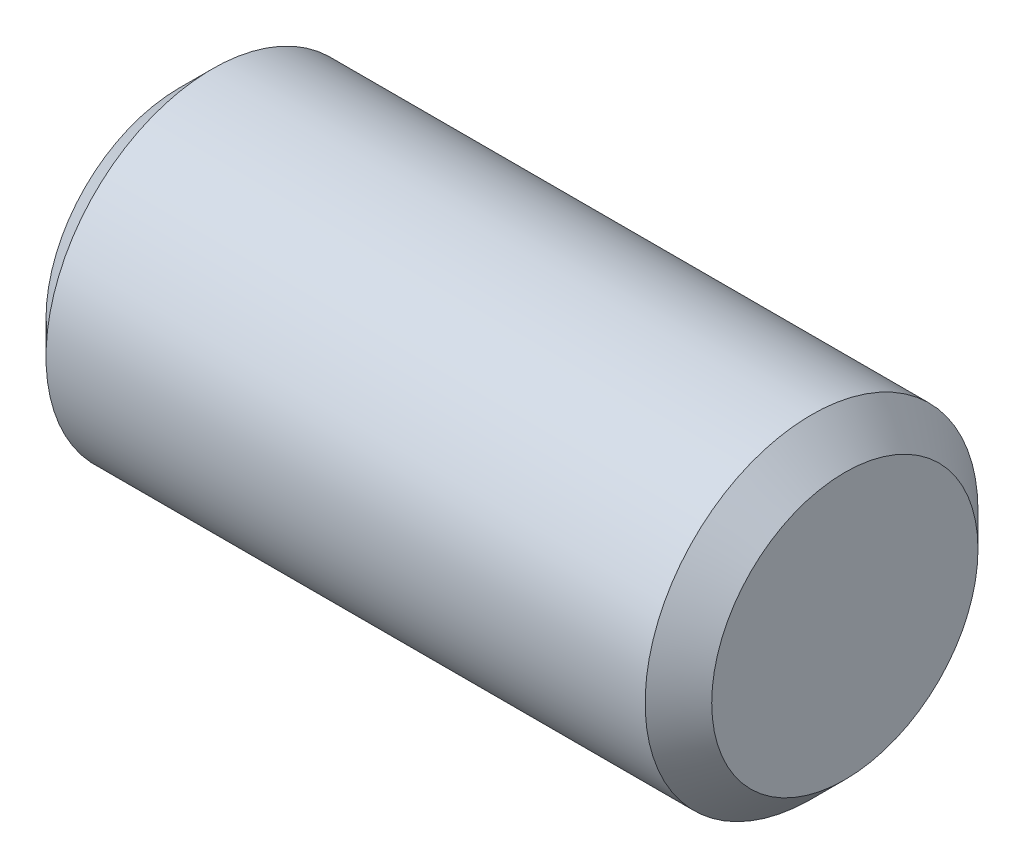
from build123d import *

# Parameters (mm, degrees)
EXTRUDE1_DEPTH      = 3.175
EXTRUDE1_DEPTH_BACK = 3.175
SKETCH2_R           = 1.5875
CHAMFER1_SIZE       = 0.3175


with BuildPart() as part:
    # Sketch2 → Extrude1 (new, two sides: drawn at the far end of the back side and taken through both)
    with BuildSketch(Plane(origin=(0, 0, 0), x_dir=(0, 0, -1), z_dir=(1, 0, 0)).offset(-EXTRUDE1_DEPTH_BACK)):
        Circle(SKETCH2_R)
    extrude(amount=EXTRUDE1_DEPTH + EXTRUDE1_DEPTH_BACK)

    # Chamfer1
    chamfer1_edges = [part.edges().sort_by_distance(p)[0] for p in [
        (-3.175, 0, 1.5875),
        (3.175, 0, 1.5875),
    ]]
    chamfer(chamfer1_edges, length=CHAMFER1_SIZE)


solid = part.part
